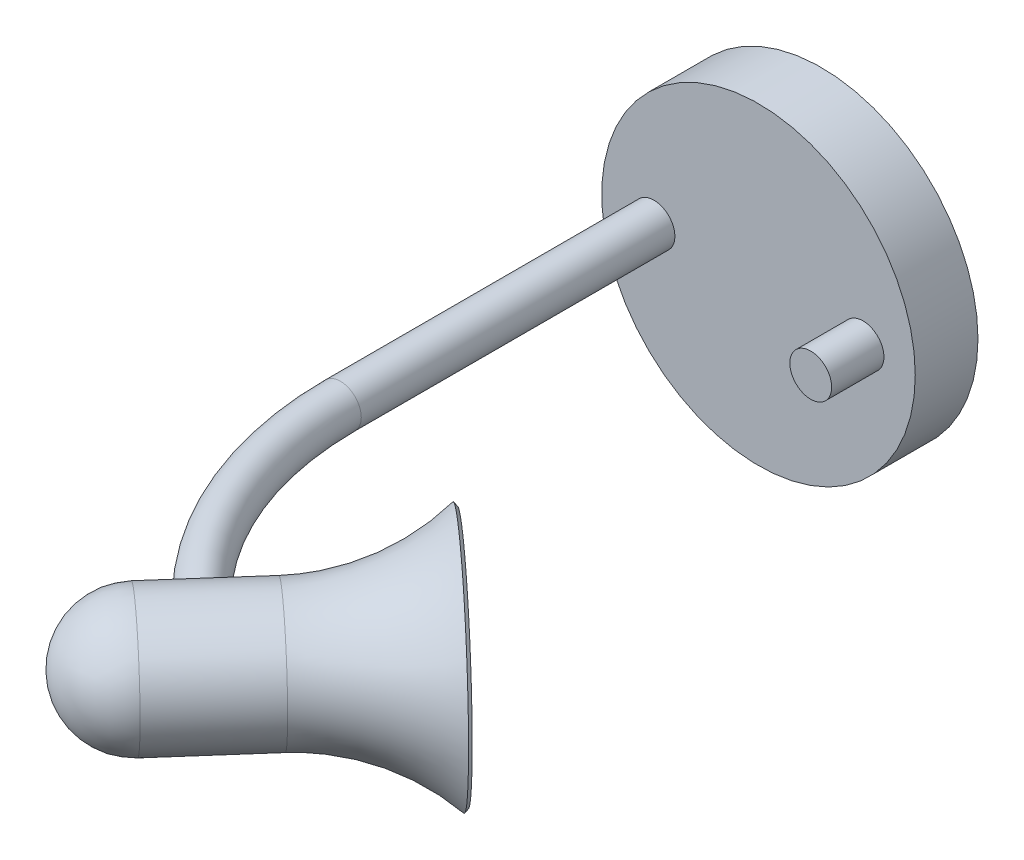
from build123d import *

# Parameters (mm, degrees)
SKETCH_1_R      = 75
EXTRUDE_1_DEPTH = 30
SKETCH_2_R      = 10
EXTRUDE_2_DEPTH = 25
SKETCH_3_R      = 10


with BuildPart() as part:
    # 草图1 → 凸台-拉伸1 (new body)
    with BuildSketch(Plane.XY):
        Circle(SKETCH_1_R)
    extrude(amount=EXTRUDE_1_DEPTH)

    # 草图2 → 凸台-拉伸2 (add)
    with BuildSketch(Plane.XY.offset(30)):
        with Locations((50, 0)):
            Circle(SKETCH_2_R)
    extrude(amount=EXTRUDE_2_DEPTH)

    # 扫描1: sweep along a path in 草图4
    with BuildLine(Plane(origin=(0, 0, 0), x_dir=(1, 0, 0), z_dir=(0, 1, 0))) as sweep_1_path:
        Line((-50, -30), (-50, -180))
        ThreePointArc((-50, -180), (-35.830052443, -245.830052443), (4.169947557, -300))
    # 草图3 → 扫描1 (sweep)
    with BuildSketch(Plane.XY.offset(30)):
        with Locations((-50, 0)):
            Circle(SKETCH_3_R)
    sweep(path=sweep_1_path.line)


with BuildPart() as body_2:
    # 草图5 → 旋转-薄壁7 (revolve)
    with BuildSketch(Plane(origin=(0, 0, 0), x_dir=(1, 0, 0), z_dir=(0, 1, 0))):
        with BuildLine():
            ThreePointArc((43.204662909, -221.25), (37.476087335, -253.320190263), (20.705893252, -281.25))
            Line((20.705893252, -281.25), (-12.365998137, -318.75))
            ThreePointArc((-12.365998137, -318.75), (-19.807115914, -340.471822209), (-9.70913297, -361.093134833))
            Line((-9.70913297, -361.093134833), (-8.386257314, -359.593134833))
            ThreePointArc((-8.386257314, -359.593134833), (-17.811041395, -340.346576384), (-10.865998137, -320.072875656))
            Line((-10.865998137, -320.072875656), (22.205893252, -282.572875656))
            ThreePointArc((22.205893252, -282.572875656), (39.348758315, -254.022403479), (45.204635568, -221.239542322))
            Line((45.204635568, -221.239542322), (43.204662909, -221.25))
        make_face()
    revolve(axis=Axis((158.834137133, 0, 169.983030042), (-0.6614378277661476, 0, 0.7500000000000001)))


solid = Compound([part.part, body_2.part])
